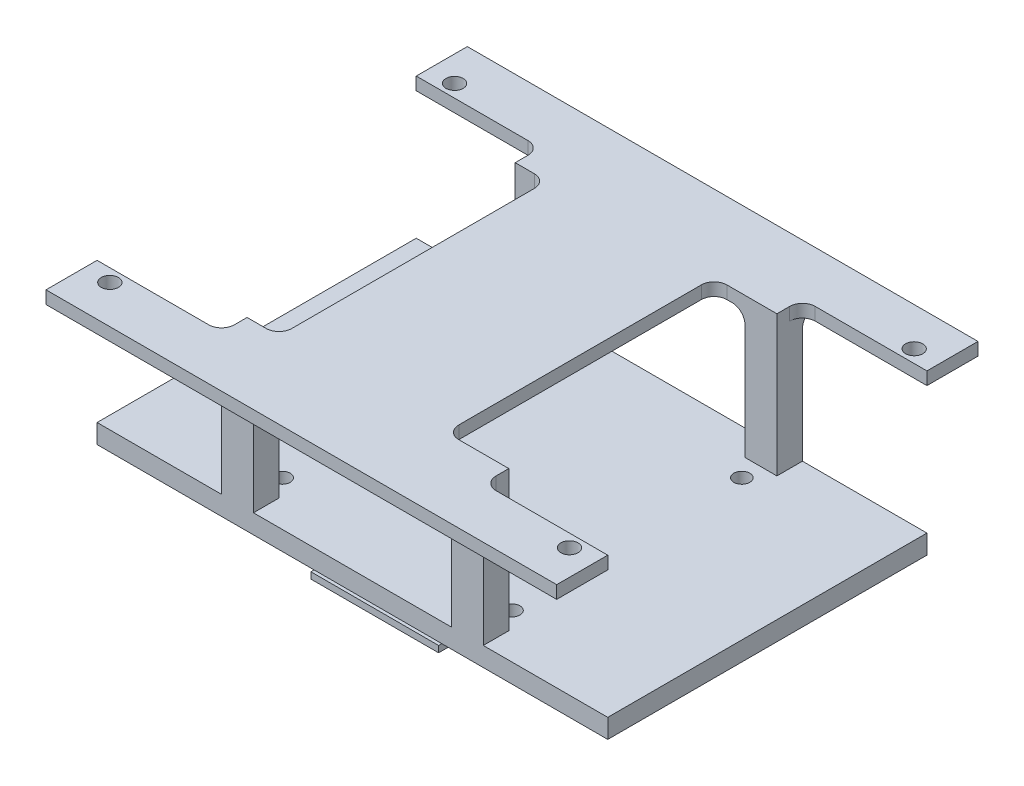
from build123d import *

# Parameters (mm, degrees)
SKETCH1_W           = 80
SKETCH1_H           = 50
BOSS_EXTRUDE1_DEPTH = 3
SKETCH2_R           = 1.25
CUT_EXTRUDE1_DEPTH  = 3
SKETCH3_W           = 5
SKETCH3_H           = 4
BOSS_EXTRUDE2_DEPTH = 22
BOSS_EXTRUDE3_DEPTH = 2
FILLET1_R           = 2
SKETCH8_W           = 80
SKETCH8_H           = 8
BOSS_EXTRUDE4_DEPTH = 2
FILLET2_R           = 2
SKETCH6_R           = 1.35
CUT_EXTRUDE2_DEPTH  = 2
SKETCH12_W          = 20
SKETCH12_H          = 3
BOSS_EXTRUDE6_DEPTH = 5
SKETCH13_W          = 20
SKETCH13_H          = 1
BOSS_EXTRUDE7_DEPTH = 10
SKETCH14_R          = 1.5
CUT_EXTRUDE5_DEPTH  = 1
FILLET3_R           = 2
FILLET4_R           = 2


with BuildPart() as part:
    # Sketch1 → Boss-Extrude1 (new body)
    with BuildSketch(Plane(origin=(0, 0, 0), x_dir=(1, 0, 0), z_dir=(0, 1, 0))):
        with Locations((40, 25)):
            Rectangle(SKETCH1_W, SKETCH1_H)
    extrude(amount=BOSS_EXTRUDE1_DEPTH)

    # Sketch2 → Cut-Extrude1 (cut)
    with BuildSketch(Plane(origin=(0, 3, 0), x_dir=(1, 0, 0), z_dir=(0, 1, 0))):
        with Locations(Location((22, 43, 0), (0, 0, 270))):
            Circle(SKETCH2_R)
        with Locations(Location((58, 43, 0), (0, 0, 270))):
            Circle(SKETCH2_R)
        with Locations(Location((22, 7, 0), (0, 0, 270))):
            Circle(SKETCH2_R)
        with Locations(Location((58, 7, 0), (0, 0, 270))):
            Circle(SKETCH2_R)
    extrude(amount=-CUT_EXTRUDE1_DEPTH, mode=Mode.SUBTRACT)

    # Sketch3 → Boss-Extrude2 (add)
    with BuildSketch(Plane(origin=(0, 3, 0), x_dir=(1, 0, 0), z_dir=(0, 1, 0))):
        with Locations((22, 2)):
            Rectangle(SKETCH3_W, SKETCH3_H)
        with Locations((22, 48)):
            Rectangle(SKETCH3_W, SKETCH3_H)
        with Locations((58, 48)):
            Rectangle(SKETCH3_W, SKETCH3_H)
        with Locations((58, 2)):
            Rectangle(SKETCH3_W, SKETCH3_H)
    extrude(amount=BOSS_EXTRUDE2_DEPTH)

    # Sketch5 → Boss-Extrude3 (add)
    with BuildSketch(Plane(origin=(0, 23, 0), x_dir=(1, 0, 0), z_dir=(0, 1, 0))):
        with BuildLine():
            Line((24.5, 50), (55.5, 50))
            Line((55.5, 50), (55.5, 46))
            Line((55.5, 46), (52.660903874, 46))
            ThreePointArc((52.660903874, 46), (51.246690312, 45.414213562), (50.660903874, 44))
            Line((50.660903874, 44), (50.660903874, 6))
            ThreePointArc((50.660903874, 6), (51.246690312, 4.585786438), (52.660903874, 4))
            Line((52.660903874, 4), (55.5, 4))
            Line((55.5, 4), (55.5, 0))
            Line((55.5, 0), (24.5, 0))
            Line((24.5, 0), (24.5, 4))
            Line((24.5, 4), (24.5, 46))
            Line((24.5, 46), (24.5, 50))
        make_face()
    extrude(amount=BOSS_EXTRUDE3_DEPTH)

    # Fillet1
    fillet1_edges = [part.edges().sort_by_distance(p)[0] for p in [
        (24.5, 24, -4),
        (24.5, 24, -46),
    ]]
    fillet(fillet1_edges, radius=FILLET1_R)

    # Sketch8 → Boss-Extrude4 (add)
    with BuildSketch(Plane(origin=(0, 25, 0), x_dir=(1, 0, 0), z_dir=(0, 1, 0))):
        with Locations((40, 54)):
            Rectangle(SKETCH8_W, SKETCH8_H)
        with Locations((40, -4)):
            Rectangle(SKETCH8_W, SKETCH8_H)
    extrude(amount=-BOSS_EXTRUDE4_DEPTH)

    # Fillet2
    fillet2_edges = [part.edges().sort_by_distance(p)[0] for p in [
        (19.5, 24, 0),
        (60.5, 24, 0),
        (60.5, 24, -50),
        (19.5, 24, -50),
    ]]
    fillet(fillet2_edges, radius=FILLET2_R)

    # Sketch6 → Cut-Extrude2 (cut)
    with BuildSketch(Plane(origin=(0, 25, 0), x_dir=(1, 0, 0), z_dir=(0, 1, 0))):
        with Locations(Location((4, -2, 0), (0, 0, 270))):
            Circle(SKETCH6_R)
        with Locations(Location((4, 52, 0), (0, 0, 270))):
            Circle(SKETCH6_R)
        with Locations(Location((76, 52, 0), (0, 0, 270))):
            Circle(SKETCH6_R)
        with Locations(Location((76, -2, 0), (0, 0, 270))):
            Circle(SKETCH6_R)
    extrude(amount=-CUT_EXTRUDE2_DEPTH, mode=Mode.SUBTRACT)

    # Sketch12 → Boss-Extrude6 (add)
    with BuildSketch(Plane.XZ):
        with Locations((40, -15)):
            Rectangle(SKETCH12_W, SKETCH12_H)
        with Locations((40, -35)):
            Rectangle(SKETCH12_W, SKETCH12_H)
    extrude(amount=BOSS_EXTRUDE6_DEPTH)

    # Sketch13 → Boss-Extrude7 (add)
    with BuildSketch(Plane.XY.offset(-13.5)):
        with Locations((40, -4.5)):
            Rectangle(SKETCH13_W, SKETCH13_H)
    boss_extrude7 = extrude(amount=BOSS_EXTRUDE7_DEPTH)

    # Sketch14 → Cut-Extrude5 (cut)
    with BuildSketch(Plane(origin=(0, -4, 0), x_dir=(1, 0, 0), z_dir=(0, 1, 0))):
        with Locations(Location((40, 10, 0), (0, 0, 270))):
            Circle(SKETCH14_R)
    cut_extrude5 = extrude(amount=-CUT_EXTRUDE5_DEPTH, mode=Mode.SUBTRACT)

    # Mirror1: Boss-Extrude7, Cut-Extrude5 across plane
    add(boss_extrude7.mirror(Plane(origin=(0, 0, -25), x_dir=(1, 0, 0), z_dir=(0, 0, -1))))
    add(cut_extrude5.mirror(Plane(origin=(0, 0, -25), x_dir=(1, 0, 0), z_dir=(0, 0, -1))), mode=Mode.SUBTRACT)

    # Fillet3
    fillet3_edges = [part.edges().sort_by_distance(p)[0] for p in [
        (58, 23, -50),
        (22, 23, -50),
        (22, 23, 0),
        (58, 23, 0),
        (24.5, 23, -2),
        (24.5, 23, -48),
        (55.5, 23, -2),
        (55.5, 23, -48),
    ]]
    fillet(fillet3_edges, radius=FILLET3_R)

    # Fillet4
    fillet4_edges = [part.edges().sort_by_distance(p)[0] for p in [
        (30, 0, -35),
        (40, 0, -36.5),
        (50, 0, -35),
        (50, 0, -15),
        (40, 0, -13.5),
        (30, 0, -15),
    ]]
    fillet(fillet4_edges, radius=FILLET4_R)


solid = part.part
